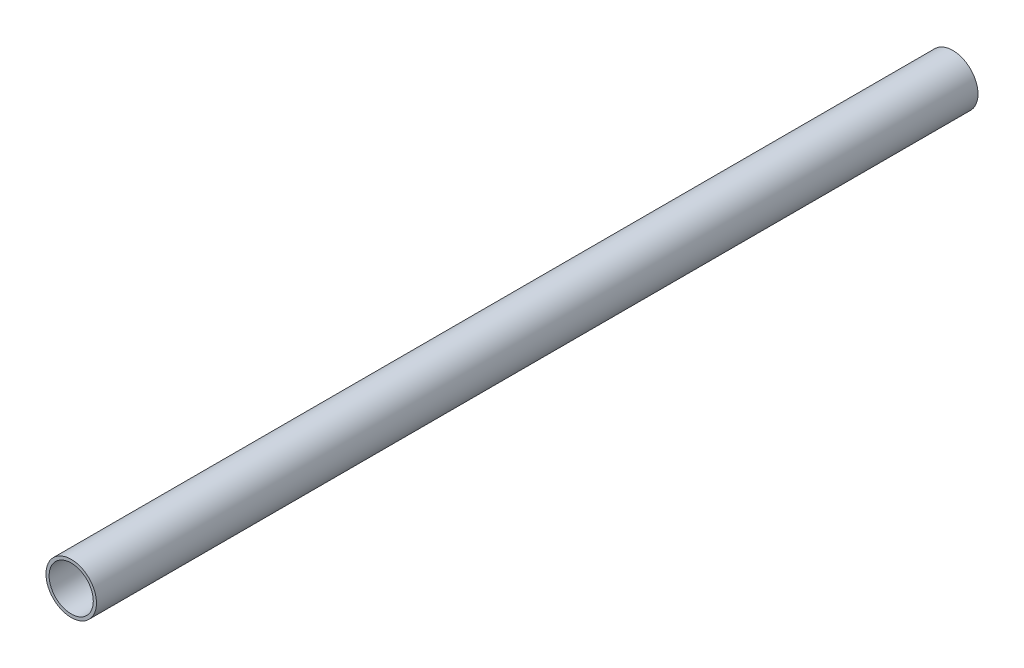
from build123d import *

# Parameters (mm, degrees)
SKETCH1_R           = 8
SKETCH1_R_2         = 7
BOSS_EXTRUDE1_DEPTH = 139.7


with BuildPart() as part:
    # Sketch1 → Boss-Extrude1 (new, symmetric)
    with BuildSketch(Plane.XY):
        Circle(SKETCH1_R)
        Circle(SKETCH1_R_2, mode=Mode.SUBTRACT)
    extrude(amount=BOSS_EXTRUDE1_DEPTH, both=True)


solid = part.part
